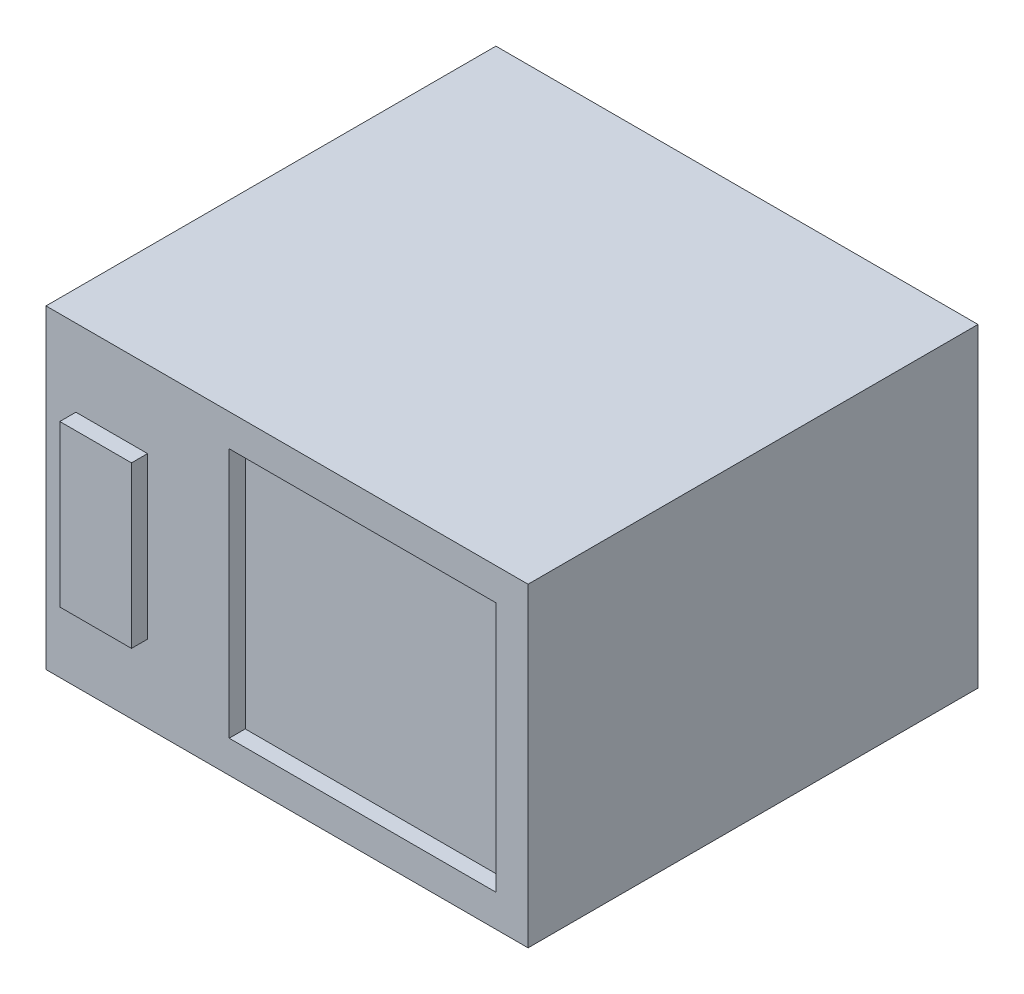
from build123d import *

# Parameters (mm, degrees)
SKETCH1_W           = 150
SKETCH1_H           = 140
BOSS_EXTRUDE1_DEPTH = 49
SKETCH2_W           = 83
SKETCH2_H           = 78
CUT_EXTRUDE1_DEPTH  = 5
SKETCH3_W           = 22.3
SKETCH3_H           = 50
BOSS_EXTRUDE2_DEPTH = 5
SKETCH4_W           = 84
SKETCH4_H           = 79
CUT_EXTRUDE2_DEPTH  = 5


with BuildPart() as part:
    # Sketch1 → Boss-Extrude1 (new, symmetric)
    with BuildSketch(Plane(origin=(0, 0, 0), x_dir=(1, 0, 0), z_dir=(0, 1, 0))):
        Rectangle(SKETCH1_W, SKETCH1_H)
    extrude(amount=BOSS_EXTRUDE1_DEPTH, both=True)

    # Sketch2 → Cut-Extrude1 (cut)
    with BuildSketch(Plane.XY.offset(70)):
        with Locations((23.5, 0)):
            Rectangle(SKETCH2_W, SKETCH2_H)
    extrude(amount=-CUT_EXTRUDE1_DEPTH, mode=Mode.SUBTRACT)

    # Sketch3 → Boss-Extrude2 (add)
    with BuildSketch(Plane.XY.offset(70)):
        with Locations((-54.55, 0)):
            Rectangle(SKETCH3_W, SKETCH3_H)
    extrude(amount=BOSS_EXTRUDE2_DEPTH)

    # Sketch4 → Cut-Extrude2 (cut)
    with BuildSketch(Plane(origin=(0, 0, -70), x_dir=(-1, 0, 0), z_dir=(0, 0, -1))):
        with Locations((18, 0)):
            Rectangle(SKETCH4_W, SKETCH4_H)
    extrude(amount=-CUT_EXTRUDE2_DEPTH, mode=Mode.SUBTRACT)


solid = part.part
